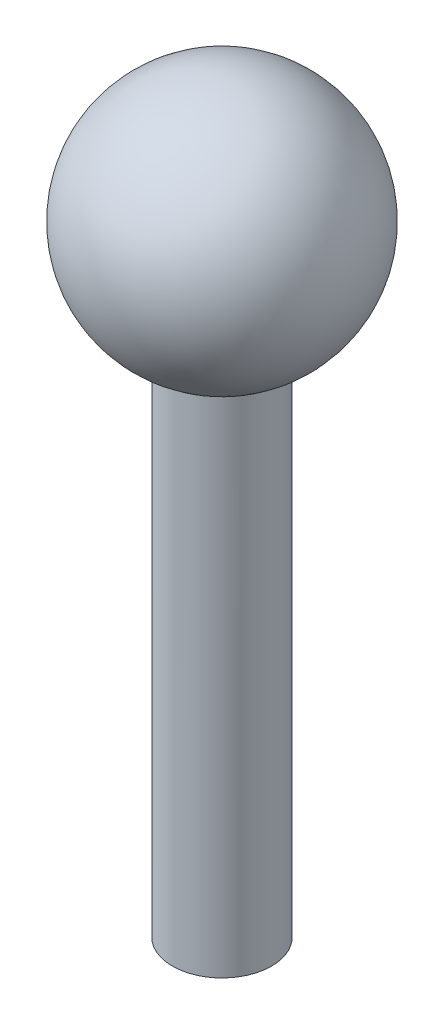
from build123d import *


with BuildPart() as part:
    # Sketch1 → Revolve1 (revolve)
    with BuildSketch(Plane.XY, mode=Mode.PRIVATE) as revolve1_sk:
        with BuildLine():
            Line((0, 0), (-4, 0))
            Line((-4, 0), (-4, 40.83484861))
            ThreePointArc((-4, 40.83484861), (-9.789063129, 52.043096437), (0, 60))
            Line((0, 60), (0, 0))
        make_face()
    revolve(revolve1_sk.sketch.rotate(Axis((0, 0, 0), (0, 1, 0)), 180), axis=Axis((0, 0, 0), (0, 1, 0)))


solid = part.part
